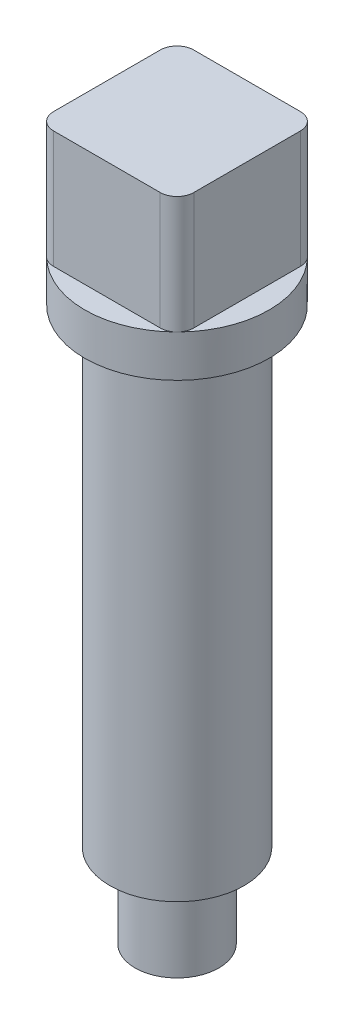
from build123d import *

# Parameters (mm, degrees)
BOSS_EXTRUDE1_DEPTH = 14


with BuildPart() as part:
    # Sketch1 → Revolve1 (revolve)
    with BuildSketch(Plane.XY, mode=Mode.PRIVATE) as revolve1_sk:
        Polygon((0, 0), (5, 0), (5, 10), (8, 10), (8, 66), (11, 66), (11, 71), (0, 71), align=None)
    revolve(revolve1_sk.sketch.rotate(Axis((0, 71, 0), (0, -1, 0)), 90), axis=Axis((0, 71, 0), (0, -1, 0)))

    # Sketch2 → Boss-Extrude1 (add)
    with BuildSketch(Plane(origin=(0, 71, 0), x_dir=(1, 0, 0), z_dir=(0, 1, 0))):
        with BuildLine():
            Line((6.363961031, 8.363961031), (-6.363961031, 8.363961031))
            ThreePointArc((-6.363961031, 8.363961031), (-7.778174593, 7.778174593), (-8.363961031, 6.363961031))
            Line((-8.363961031, 6.363961031), (-8.363961031, -6.363961031))
            ThreePointArc((-8.363961031, -6.363961031), (-7.778174593, -7.778174593), (-6.363961031, -8.363961031))
            Line((-6.363961031, -8.363961031), (6.363961031, -8.363961031))
            ThreePointArc((6.363961031, -8.363961031), (7.778174593, -7.778174593), (8.363961031, -6.363961031))
            Line((8.363961031, -6.363961031), (8.363961031, 6.363961031))
            ThreePointArc((8.363961031, 6.363961031), (7.778174593, 7.778174593), (6.363961031, 8.363961031))
        make_face()
    extrude(amount=BOSS_EXTRUDE1_DEPTH)


solid = part.part
